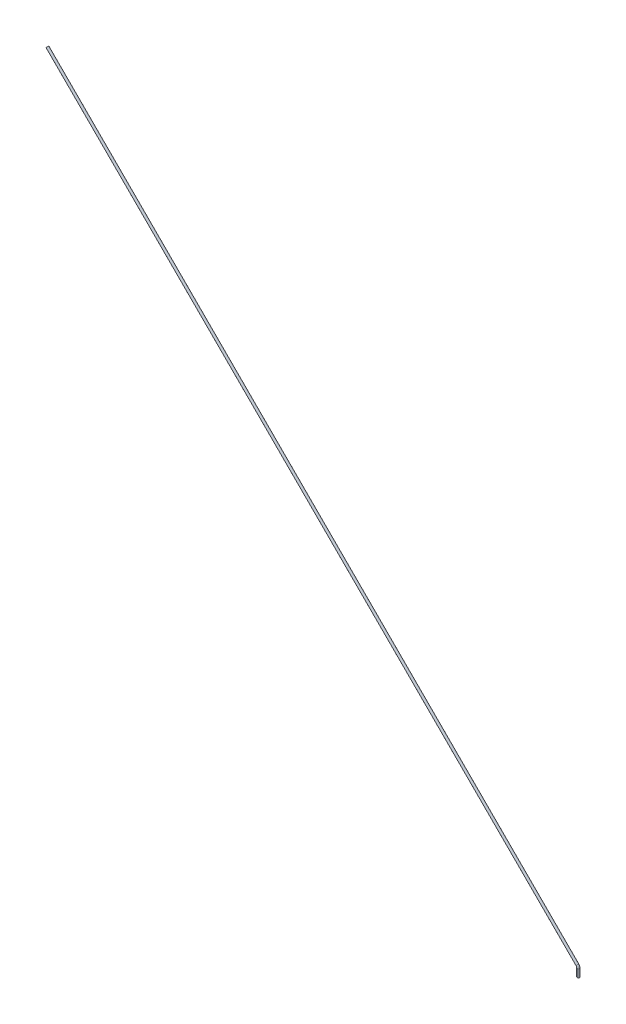
from build123d import *

# Parameters (mm, degrees)
SKETCH1_R = 0.25


with BuildPart() as part:
    # Sweep1: sweep along a path in Sketch2
    with BuildLine(Plane.XY) as sweep1_path:
        Line((0, 0), (0, 1.689339828))
        ThreePointArc((0, 1.689339828), (-0.057090351, 1.976352402), (-0.219669914, 2.219669914))
        Line((-0.219669914, 2.219669914), (-115.258405333, 117.258405333))
    # Sketch1 → Sweep1 (sweep)
    with BuildSketch(Plane(origin=(0, 0, 0), x_dir=(1, 0, 0), z_dir=(0, 1, 0))):
        Circle(SKETCH1_R)
    sweep(path=sweep1_path.line)


solid = part.part
